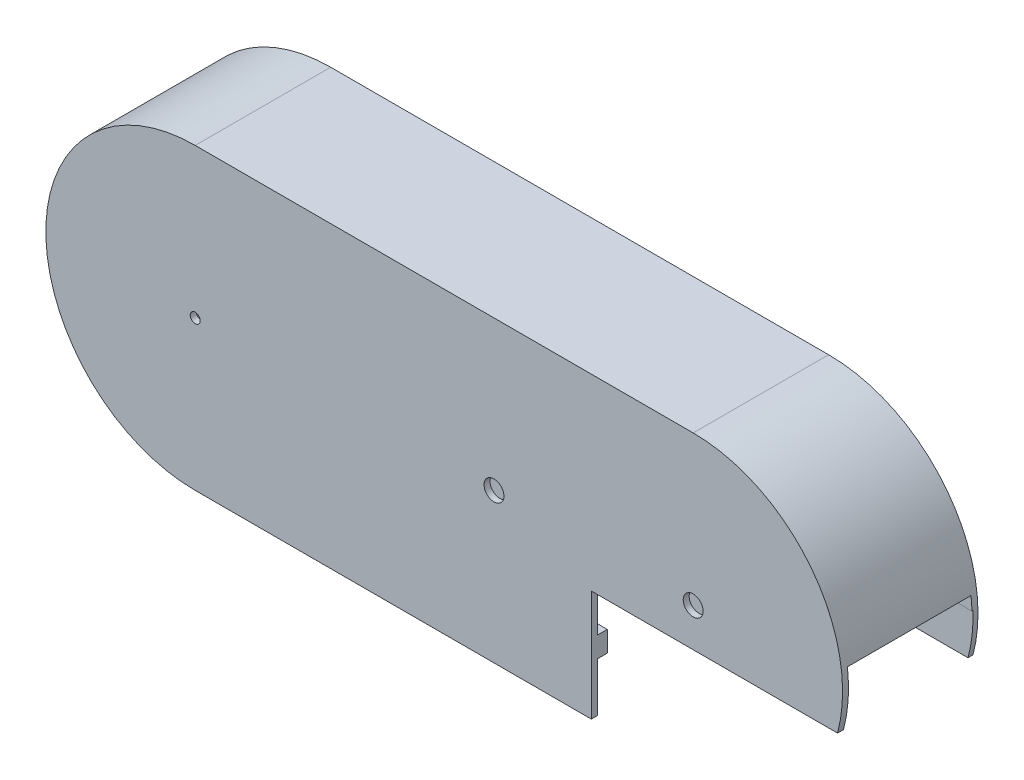
from build123d import *

# Parameters (mm, degrees)
EXTRUDE_1_DEPTH          = 68
CUT_EXTRUDE_2_DEPTH      = 62
SKETCH_3_W               = 250
SKETCH_3_H               = 65
CUT_EXTRUDE_3_DEPTH      = 3
CUT_EXTRUDE_5_DEPTH      = 340.816126751
CUT_EXTRUDE_5_DEPTH_BACK = 340.816126751
CUT_EXTRUDE_6_DEPTH      = 340.816126751
CUT_EXTRUDE_6_DEPTH_BACK = 340.816126751
SKETCH_5_R               = 5
SKETCH_6_W               = 62.5
SKETCH_6_H               = 77.5
CUT_EXTRUDE_7_DEPTH      = 80
CUT_EXTRUDE_8_DEPTH      = 340.816126751
CUT_EXTRUDE_8_DEPTH_BACK = 340.816126751
SKETCH_7_W               = 123.617687057
SKETCH_7_H               = 55.714084123
SKETCH_8_R               = 5
EXTRUDE_2_DEPTH          = 6
EXTRUDE_START            = 6
EXTRUDE_3_DEPTH          = 6
EXTRUDE_4_DEPTH          = 5
PATTERN_LINEAR_1_COUNT   = 2
PATTERN_LINEAR_1_PITCH   = 57
SKETCH_12_W              = 62
SKETCH_12_H              = 9.024181297
CUT_EXTRUDE_9_DEPTH      = 10


with BuildPart() as part:
    # 草图1 → 凸台-拉伸1 (new body)
    with BuildSketch(Plane.XY):
        with BuildLine():
            Line((0, 75), (250, 75))
            ThreePointArc((250, 75), (325, 0), (250, -75))
            Line((250, -75), (0, -75))
            ThreePointArc((0, -75), (-75, 0), (0, 75))
        make_face()
    extrude(amount=EXTRUDE_1_DEPTH)

    # 草图2 → 切除-拉伸2 (cut)
    with BuildSketch(Plane.XY.offset(65)):
        with BuildLine():
            Line((0, 72), (250, 72))
            ThreePointArc((250, 72), (322, 0), (250, -72))
            Line((250, -72), (0, -72))
            ThreePointArc((0, -72), (-72, 0), (0, 72))
        make_face()
    extrude(amount=-CUT_EXTRUDE_2_DEPTH, mode=Mode.SUBTRACT)

    # 草图3 → 切除-拉伸3 (cut)
    with BuildSketch(Plane(origin=(0, -75, 0), x_dir=(-1, 0, 0), z_dir=(0, -1, 0))):
        with Locations((-125, -32.5)):
            Rectangle(SKETCH_3_W, SKETCH_3_H)
    extrude(amount=-CUT_EXTRUDE_3_DEPTH, mode=Mode.SUBTRACT)

    # 草图4 → 切除-拉伸5 (cut, two sides: drawn at the far end of the back side and taken through both)
    with BuildSketch(Plane.XY.offset(65).offset(-CUT_EXTRUDE_5_DEPTH_BACK)):
        with BuildLine():
            ThreePointArc((2.5, 0), (1.767766953, 1.767766953), (0, 2.5))
            Line((0, 2.5), (0, -2.5))
            ThreePointArc((0, -2.5), (1.767766953, -1.767766953), (2.5, 0))
        make_face()
        with BuildLine():
            Line((0, -2.5), (0, 2.5))
            ThreePointArc((0, 2.5), (-2.5, 0), (0, -2.5))
        make_face()
    extrude(amount=CUT_EXTRUDE_5_DEPTH + CUT_EXTRUDE_5_DEPTH_BACK, mode=Mode.SUBTRACT)

    # 草图5 → 切除-拉伸6 (cut, two sides: drawn at the far end of the back side and taken through both)
    with BuildSketch(Plane.XY.offset(65).offset(-CUT_EXTRUDE_6_DEPTH_BACK)):
        with Locations((250, 0)):
            Circle(SKETCH_5_R)
        with Locations((150, 0)):
            Circle(SKETCH_5_R)
    extrude(amount=CUT_EXTRUDE_6_DEPTH + CUT_EXTRUDE_6_DEPTH_BACK, mode=Mode.SUBTRACT)

    # 草图6 → 切除-拉伸7 (cut)
    with BuildSketch(Plane(origin=(325, 0, 0), x_dir=(0, 0, -1), z_dir=(1, 0, 0))):
        with Locations((-33.75, -36.25)):
            Rectangle(SKETCH_6_W, SKETCH_6_H)
    extrude(amount=-CUT_EXTRUDE_7_DEPTH, mode=Mode.SUBTRACT)

    # 草图7 → 切除-拉伸8 (cut, two sides: drawn at the far end of the back side and taken through both)
    with BuildSketch(Plane.XY.offset(65).offset(-CUT_EXTRUDE_8_DEPTH_BACK)):
        with Locations((260.669107939, -47.142957939)):
            Rectangle(SKETCH_7_W, SKETCH_7_H)
    extrude(amount=CUT_EXTRUDE_8_DEPTH + CUT_EXTRUDE_8_DEPTH_BACK, mode=Mode.SUBTRACT)

    # 草图8 → 凸台-拉伸2 (add)
    with BuildSketch(Plane(origin=(0, 0, 65), x_dir=(-1, 0, 0), z_dir=(0, 0, -1))):
        with Locations(Location((-32.64, 0, 0), (0, 0, 180))):
            Circle(SKETCH_8_R)
    extrude(amount=EXTRUDE_2_DEPTH)

    # 草图9 → 凸台-拉伸3 (add)
    with BuildSketch(Plane.XY.offset(3).offset(EXTRUDE_START)):
        with BuildLine():
            ThreePointArc((37.64, 0), (32.64, 5), (27.64, 0))
            Line((27.64, 0), (37.64, 0))
        make_face()
        with BuildLine():
            Line((37.64, 0), (27.64, 0))
            ThreePointArc((27.64, 0), (32.64, -5), (37.64, 0))
        make_face()
    extrude(amount=-EXTRUDE_3_DEPTH)

    # 草图10 → 凸台-拉伸4 (add)
    with BuildSketch(Plane.XY.offset(3)):
        Polygon((-52.288307715, 53.767396034), (302.288307715, 53.767396034), (309.461936105, 45.708622323), (-58.724061421, 46.652809243), align=None)
        Polygon((-63.45501943, -39.980751734), (198.86026441, -39.980751734), (198.86026441, -50.331270565), (-55.603625811, -50.331270565), align=None)
    extrude_4 = extrude(amount=EXTRUDE_4_DEPTH)

    # 阵列(线性)1: 凸台-拉伸4 ×2
    with Locations(*[(0, 0, i * PATTERN_LINEAR_1_PITCH) for i in range(1, PATTERN_LINEAR_1_COUNT)]):
        add(extrude_4)

    # 草图12 → 切除-拉伸9 (cut)
    with BuildSketch(Plane(origin=(325, 0, 0), x_dir=(0, 0, -1), z_dir=(1, 0, 0))):
        with Locations((-34, 4.512090649)):
            Rectangle(SKETCH_12_W, SKETCH_12_H)
    extrude(amount=-CUT_EXTRUDE_9_DEPTH, mode=Mode.SUBTRACT)


solid = part.part
